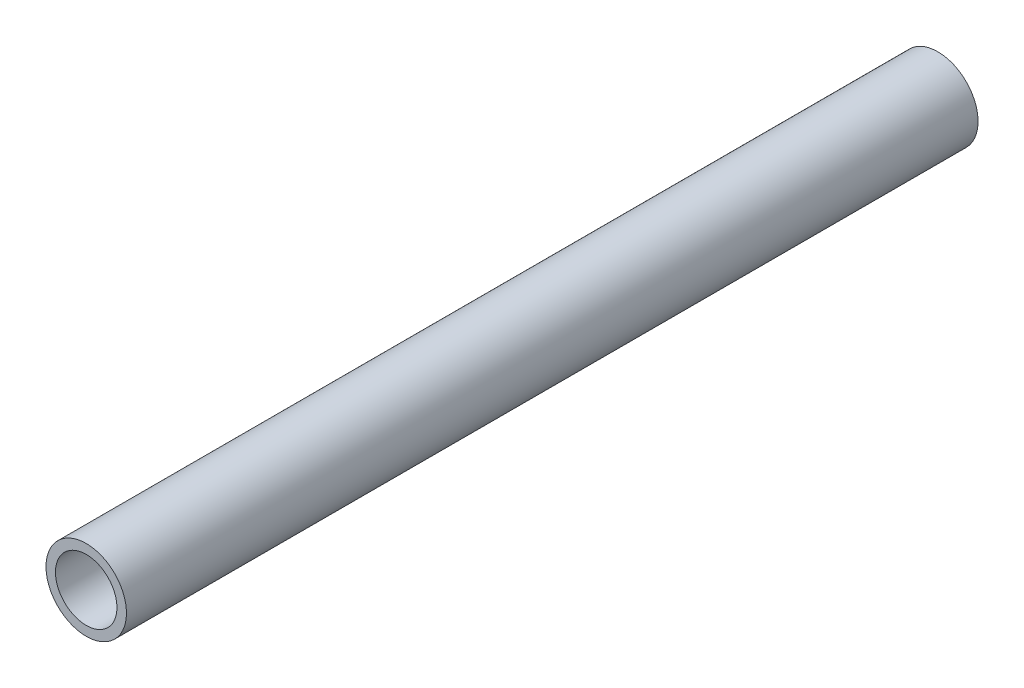
from build123d import *

# Parameters (mm, degrees)
SCHIZZO1_R                   = 4.25
SCHIZZO1_R_2                 = 3.25
ESTRUSIONE_ESTRUSIONE1_DEPTH = 90


with BuildPart() as part:
    # Schizzo1 → Estrusione-Estrusione1 (new body)
    with BuildSketch(Plane.XY):
        with Locations(Location((0, 0, 0), (0, 0, 180))):
            Circle(SCHIZZO1_R)
        with Locations(Location((0, 0, 0), (0, 0, 180))):
            Circle(SCHIZZO1_R_2, mode=Mode.SUBTRACT)
    extrude(amount=ESTRUSIONE_ESTRUSIONE1_DEPTH)


solid = part.part
